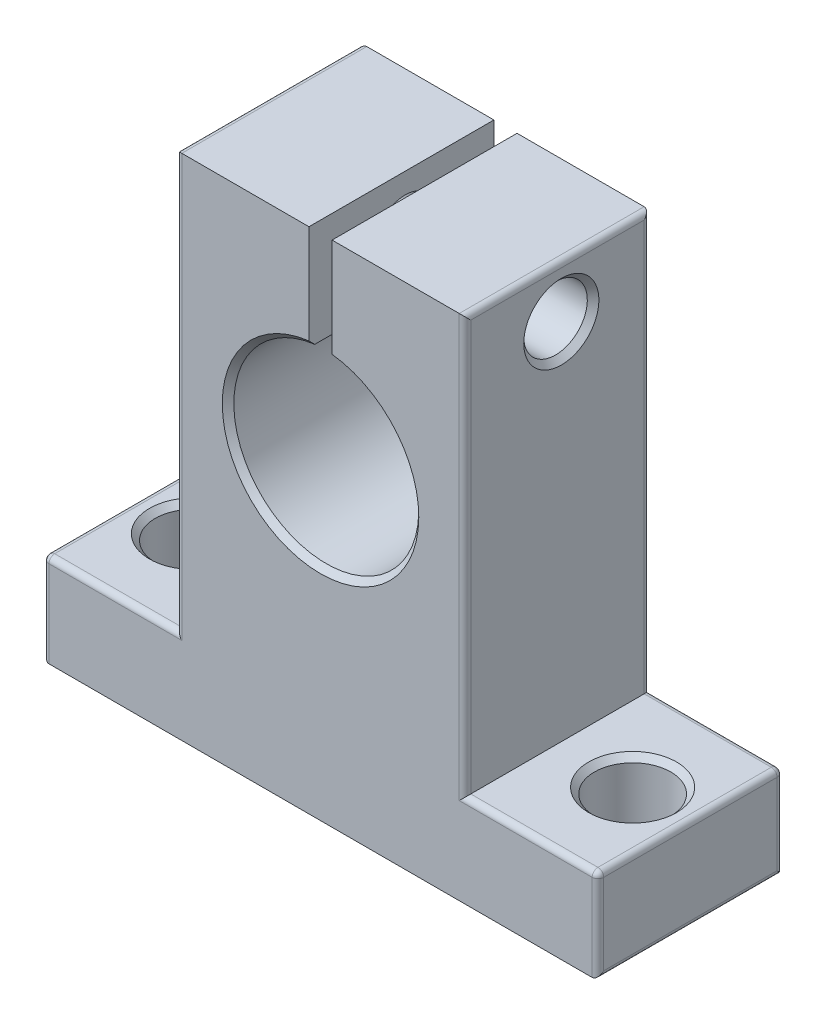
from build123d import *

# Parameters (mm, degrees)
BOSS_EXTRUDE1_DEPTH     = 8
SKETCH2_R               = 3.3
CUT_EXTRUDE1_DEPTH      = 45
CUT_EXTRUDE2_DEPTH      = 48.843494856
CUT_EXTRUDE2_DEPTH_BACK = 48.843494856
SKETCH5_R               = 2.75
CHAMFER2_SIZE           = 0.5
FILLET2_R               = 0.5


with BuildPart() as part:
    # Sketch1 → Boss-Extrude1 (new, symmetric)
    with BuildSketch(Plane.XY):
        with BuildLine():
            Line((-24, -4), (-24, 4))
            Line((-24, 4), (-12.5, 4))
            Line((-12.5, 4), (-12.5, 40))
            Line((-12.5, 40), (-1, 40))
            Line((-1, 40), (-1, 30.937253933))
            ThreePointArc((-1, 30.937253933), (0, 15), (1, 30.937253933))
            Line((1, 30.937253933), (1, 40))
            Line((1, 40), (12.5, 40))
            Line((12.5, 40), (12.5, 4))
            Line((12.5, 4), (24, 4))
            Line((24, 4), (24, -4))
            Line((24, -4), (-24, -4))
        make_face()
    extrude(amount=BOSS_EXTRUDE1_DEPTH, both=True)

    # Sketch2 → Cut-Extrude1 (cut, through all)
    with BuildSketch(Plane(origin=(0, 4, 0), x_dir=(1, 0, 0), z_dir=(0, 1, 0))):
        with Locations(Location((19, 0, 0), (0, 0, 180))):
            Circle(SKETCH2_R)
        with Locations((-19, 0)):
            Circle(SKETCH2_R)
    extrude(amount=-CUT_EXTRUDE1_DEPTH, mode=Mode.SUBTRACT)

    # Sketch5 → Cut-Extrude2 (cut, two sides: drawn at the far end of the back side and taken through both)
    with BuildSketch(Plane(origin=(-1, 0, 0), x_dir=(0, 0, -1), z_dir=(1, 0, 0)).offset(-CUT_EXTRUDE2_DEPTH_BACK)):
        with Locations((0.330734984, 35.468626967)):
            Circle(SKETCH5_R)
    extrude(amount=CUT_EXTRUDE2_DEPTH + CUT_EXTRUDE2_DEPTH_BACK, mode=Mode.SUBTRACT)

    # Chamfer2
    chamfer2_edges = [part.edges().sort_by_distance(p)[0] for p in [
        (0, 15, -8),
        (0, 15, 8),
        (22.3, 4, 0),
        (-22.3, 4, 0),
        (-12.5, 35.468626967, 2.419265016),
        (12.5, 35.468626967, 2.419265016),
    ]]
    chamfer(chamfer2_edges, length=CHAMFER2_SIZE)

    # Fillet2
    fillet2_edges = [part.edges().sort_by_distance(p)[0] for p in [
        (-18.25, 4, 8),
        (12.5, 22, -8),
        (18.25, 4, -8),
        (-24, 0, 8),
        (24, 0, -8),
        (-24, 0, -8),
        (-18.25, 4, -8),
        (-12.5, 22, -8),
        (24, 0, 8),
        (12.5, 40, 0),
        (24, 4, 0),
        (24, -4, 0),
        (-24, -4, 0),
        (-24, 4, 0),
        (-12.5, 40, 0),
        (18.25, 4, 8),
        (12.5, 22, 8),
        (-12.5, 22, 8),
    ]]
    fillet(fillet2_edges, radius=FILLET2_R)


solid = part.part
